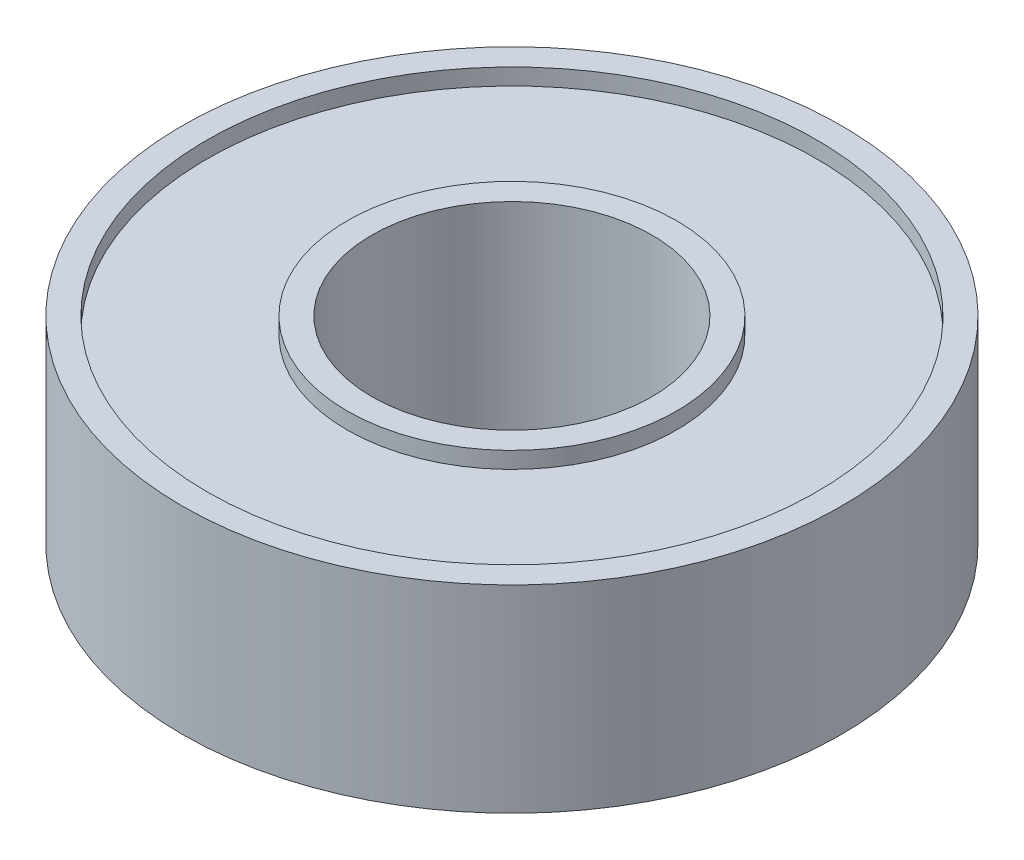
from build123d import *

# Parameters (mm, degrees)
SKETCH1_R           = 20
SKETCH1_R_2         = 8.5
BOSS_EXTRUDE1_DEPTH = 12
SKETCH2_R           = 18.5
SKETCH2_R_2         = 10
CUT_EXTRUDE1_DEPTH  = 1
CUT_EXTRUDE2_START  = -1
SKETCH3_R           = 18.5
SKETCH3_R_2         = 10
CUT_EXTRUDE2_DEPTH  = 1


with BuildPart() as part:
    # Sketch1 → Boss-Extrude1 (new body)
    with BuildSketch(Plane(origin=(0, 0, 0), x_dir=(1, 0, 0), z_dir=(0, 1, 0))):
        with Locations(Location((0, 0, 0), (0, 0, 270))):
            Circle(SKETCH1_R)
        with Locations(Location((0, 0, 0), (0, 0, 270))):
            Circle(SKETCH1_R_2, mode=Mode.SUBTRACT)
    extrude(amount=BOSS_EXTRUDE1_DEPTH)

    # Sketch2 → Cut-Extrude1 (cut)
    with BuildSketch(Plane(origin=(0, 12, 0), x_dir=(1, 0, 0), z_dir=(0, 1, 0))):
        with Locations(Location((0, 0, 0), (0, 0, 270))):
            Circle(SKETCH2_R)
        with Locations(Location((0, 0, 0), (0, 0, 270))):
            Circle(SKETCH2_R_2, mode=Mode.SUBTRACT)
    extrude(amount=-CUT_EXTRUDE1_DEPTH, mode=Mode.SUBTRACT)

    # Sketch3 → Cut-Extrude2 (cut)
    with BuildSketch(Plane.XZ.offset(CUT_EXTRUDE2_START)):
        with Locations(Location((0, 0, 0), (0, 0, 90))):
            Circle(SKETCH3_R)
        with Locations(Location((0, 0, 0), (0, 0, 90))):
            Circle(SKETCH3_R_2, mode=Mode.SUBTRACT)
    extrude(amount=CUT_EXTRUDE2_DEPTH, mode=Mode.SUBTRACT)


solid = part.part
